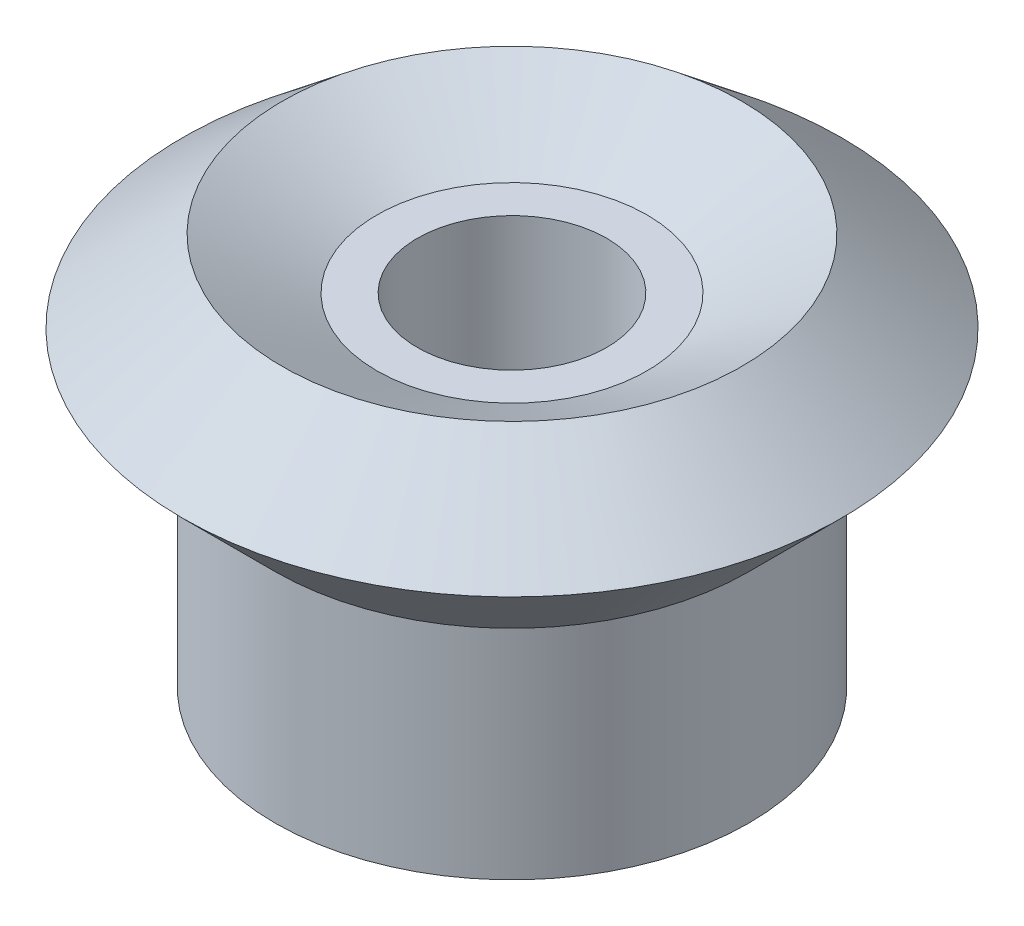
from build123d import *


with BuildPart() as part:
    # Sketch1 → Revolve1 (revolve)
    with BuildSketch(Plane.XY, mode=Mode.PRIVATE) as revolve1_sk:
        Polygon((17.4, 16.4), (12.132173, 20.7), (7.132173, 18), (5, 18), (5, 0), (12.5, 0), (12.5, 11.5), align=None)
    revolve(revolve1_sk.sketch.rotate(Axis((0, 20.7, 0), (0, -1, 0)), 270), axis=Axis((0, 20.7, 0), (0, -1, 0)))


solid = part.part
